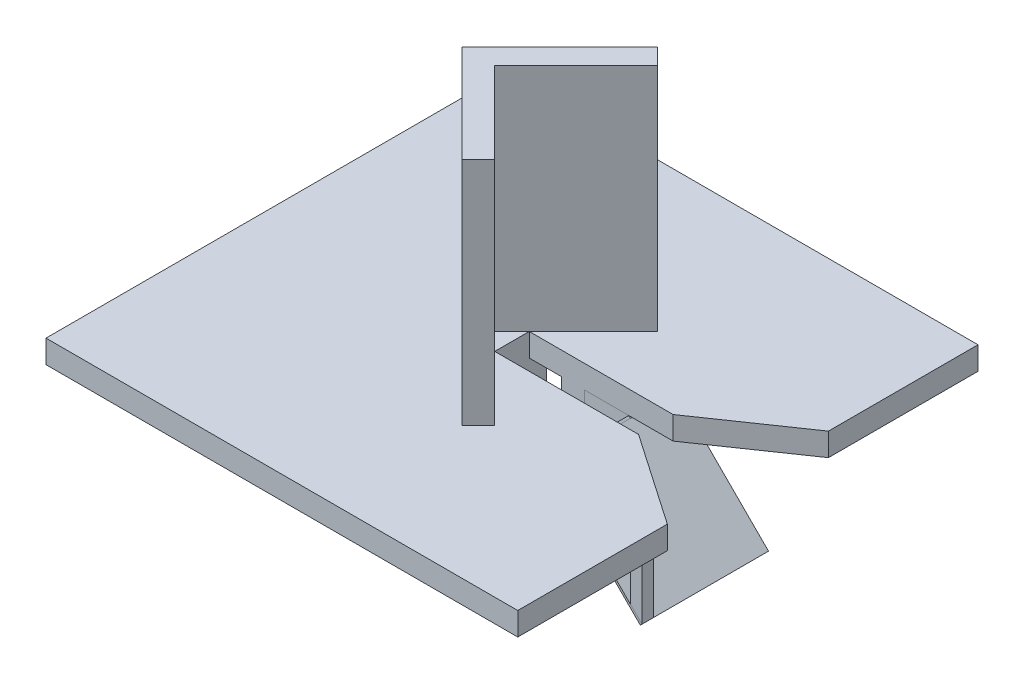
from build123d import *

# Parameters (mm, degrees)
BOSS_EXTRUDE1_DEPTH       = 10
BOSS_EXTRUDE2_DEPTH       = 110
BOSS_EXTRUDE3_DEPTH       = 10
SKETCH6_W                 = 10
SKETCH6_H                 = 10
BOSS_EXTRUDE4_DEPTH       = 20
SKETCH7_W                 = 35
SKETCH7_H                 = 20
BOSS_EXTRUDE6_DEPTH       = 10
BOSS_EXTRUDE8_DEPTH       = 15
BOSS_EXTRUDE10_DEPTH      = 2
BOSS_EXTRUDE12_DEPTH      = 2
BOSS_EXTRUDE13_DEPTH      = 20
BOSS_EXTRUDE13_DEPTH_BACK = 35
BOSS_EXTRUDE15_DEPTH      = 5


with BuildPart() as part:
    # Sketch1 → Boss-Extrude1 (new body)
    with BuildSketch(Plane(origin=(0, 0, 0), x_dir=(1, 0, 0), z_dir=(0, 1, 0))):
        Polygon((102.5, -35), (102.5, -100), (-102.5, -100), (-102.5, 100), (102.5, 100), (102.5, 35), (62.5, 7.5), (0, 7.5), (0, -7.5), (62.5, -7.5), align=None)
    extrude(amount=BOSS_EXTRUDE1_DEPTH)

    # Sketch2 → Boss-Extrude2 (add)
    with BuildSketch(Plane(origin=(0, 0, 0), x_dir=(1, 0, 0), z_dir=(0, 1, 0))):
        Polygon((-7.5, 0), (0, 7.5), (27.855339059, 35.355339059), (20.784271247, 42.426406871), (-14.571067812, 7.071067812), (-21.642135624, 0), (-14.571067812, -7.071067812), (20.784271247, -42.426406871), (27.855339059, -35.355339059), align=None)
    extrude(amount=BOSS_EXTRUDE2_DEPTH)

    # Sketch4 → Boss-Extrude3 (add)
    with BuildSketch(Plane(origin=(0, 0, 0), x_dir=(0, 0, -1), z_dir=(1, 0, 0))):
        Polygon((-15, -40), (-7.5, -40), (7.5, -40), (15, -40), (15, 0), (-15, 0), align=None)
    extrude(amount=-BOSS_EXTRUDE3_DEPTH)

    # Sketch6 → Boss-Extrude4 (add)
    with BuildSketch(Plane(origin=(0, 0, 0), x_dir=(1, 0, 0), z_dir=(0, 1, 0))):
        with Locations((19, -12.5)):
            Rectangle(SKETCH6_W, SKETCH6_H)
        Polygon((14, 17.5), (14, 15), (14, 7.5), (24, 7.5), (24, 17.5), align=None)
    extrude(amount=-BOSS_EXTRUDE4_DEPTH)

    # Sketch7 → Boss-Extrude6 (add)
    with BuildSketch(Plane.ZY.offset(-24)):
        with Locations((0, -30)):
            Rectangle(SKETCH7_W, SKETCH7_H)
    extrude(amount=BOSS_EXTRUDE6_DEPTH)


with BuildPart() as body_2:
    # Sketch13 → Boss-Extrude8 (new body)
    with BuildSketch(Plane.XY.offset(7.5)):
        Polygon((24, -20), (43.25, 0), (43.970486853, -0.693468596), (24, -21.442026366), align=None)
    extrude(amount=-BOSS_EXTRUDE8_DEPTH)

    # Sketch19 → Boss-Extrude13 (add, two sides: drawn at the far end of the back side and taken through both)
    with BuildSketch(Plane.XY.offset(7.5).offset(-BOSS_EXTRUDE13_DEPTH_BACK)):
        Polygon((43.276891667, -1.414086972), (43.970486853, -0.693468596), (83.970486853, -40.693468596), (83.263380072, -41.400575378), align=None)
    extrude(amount=BOSS_EXTRUDE13_DEPTH + BOSS_EXTRUDE13_DEPTH_BACK)


with BuildPart() as body_3:
    # Sketch15 → Boss-Extrude10 (new body)
    with BuildSketch(Plane.XY.offset(7.5)):
        Polygon((24, -20), (24, 0), (43.25, 0), align=None)
    extrude(amount=BOSS_EXTRUDE10_DEPTH)


with BuildPart() as body_4:
    # Sketch16 → Boss-Extrude12 (new body)
    with BuildSketch(Plane.XY.offset(-7.5)):
        Polygon((24, 0), (24, -20), (43.25, 0), align=None)
    extrude(amount=-BOSS_EXTRUDE12_DEPTH)


with BuildPart() as body_5:
    # Sketch20 → Boss-Extrude15 (new body)
    with BuildSketch(Plane.XY.offset(27.5)):
        Polygon((83.970486853, -40.693468596), (83.970486853, 0), (78.970486853, 0), (78.970486853, -35.693468596), align=None)
    extrude(amount=-BOSS_EXTRUDE15_DEPTH)


solid = Compound([part.part, body_2.part, body_3.part, body_4.part, body_5.part])
